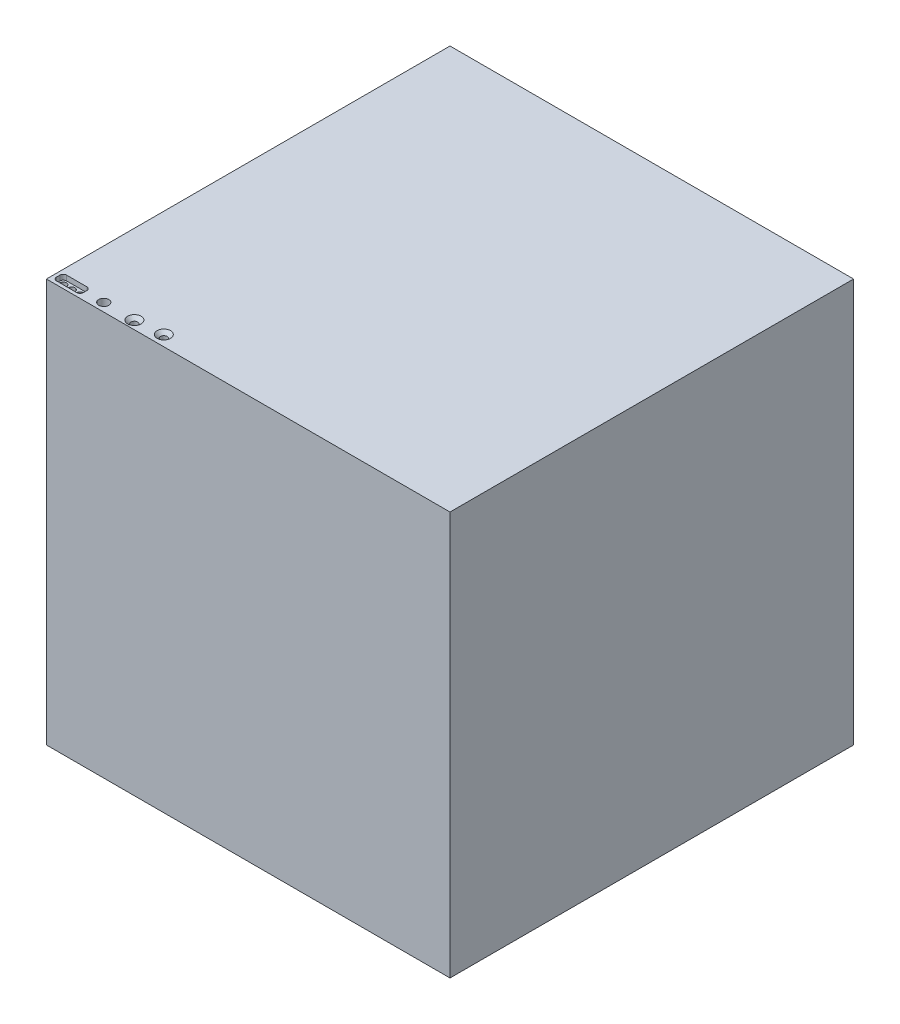
from build123d import *

# Parameters (mm, degrees)
SKETCH1_W           = 1200
SKETCH1_H           = 1200
BOSS_EXTRUDE1_DEPTH = 1200
SKETCH3_W           = 80
SKETCH3_H           = 30
CUT_EXTRUDE2_DEPTH  = 15
FILLET1_R           = 10
SKETCH4_R           = 10
CUT_EXTRUDE3_DEPTH  = 15
SKETCH5_R           = 10
CUT_EXTRUDE4_DEPTH  = 2070.8369501
SKETCH6_R           = 15
CUT_EXTRUDE5_DEPTH  = 100
SKETCH8_R           = 7.5
CUT_EXTRUDE6_DEPTH  = 100
SKETCH11_R          = 10
CUT_EXTRUDE7_DEPTH  = 250
CHAMFER1_SIZE       = 10
SKETCH12_R          = 10
CUT_EXTRUDE8_DEPTH  = 30.004
CHAMFER2_SIZE       = 10


with BuildPart() as part:
    # Sketch1 → Boss-Extrude1 (new body)
    with BuildSketch(Plane(origin=(0, 0, 0), x_dir=(1, 0, 0), z_dir=(0, 1, 0))):
        with Locations((600, 600)):
            Rectangle(SKETCH1_W, SKETCH1_H)
    extrude(amount=BOSS_EXTRUDE1_DEPTH)

    # Sketch3 → Cut-Extrude2 (cut)
    with BuildSketch(Plane(origin=(0, 1200, 0), x_dir=(1, 0, 0), z_dir=(0, 1, 0))):
        with Locations((50, 25)):
            Rectangle(SKETCH3_W, SKETCH3_H)
    extrude(amount=-CUT_EXTRUDE2_DEPTH, mode=Mode.SUBTRACT)

    # Fillet1
    fillet1_edges = [part.edges().sort_by_distance(p)[0] for p in [
        (10, 1192.5, -10),
        (10, 1192.5, -40),
        (90, 1192.5, -40),
        (90, 1192.5, -10),
    ]]
    fillet(fillet1_edges, radius=FILLET1_R)

    # Sketch4 → Cut-Extrude3 (cut)
    with BuildSketch(Plane(origin=(0, 1185, 0), x_dir=(1, 0, 0), z_dir=(0, 1, 0))):
        with Locations(Location((25, 25, 0), (0, 0, 270))):
            Circle(SKETCH4_R)
        with Locations(Location((75, 25, 0), (0, 0, 270))):
            Circle(SKETCH4_R)
    extrude(amount=-CUT_EXTRUDE3_DEPTH, mode=Mode.SUBTRACT)

    # Sketch5 → Cut-Extrude4 (cut, through all)
    with BuildSketch(Plane(origin=(0, 1185, 0), x_dir=(1, 0, 0), z_dir=(0, 1, 0))):
        with Locations(Location((50, 25, 0), (0, 0, 270))):
            Circle(SKETCH5_R)
    extrude(amount=-CUT_EXTRUDE4_DEPTH, mode=Mode.SUBTRACT)

    # Sketch6 → Cut-Extrude5 (cut)
    with BuildSketch(Plane(origin=(0, 1200, 0), x_dir=(1, 0, 0), z_dir=(0, 1, 0))):
        with Locations(Location((145.500055777, 25, 0), (0, 0, 270))):
            Circle(SKETCH6_R)
    extrude(amount=-CUT_EXTRUDE5_DEPTH, mode=Mode.SUBTRACT)

    # Sketch8 → Cut-Extrude6 (cut)
    with BuildSketch(Plane(origin=(0, 1100, 0), x_dir=(1, 0, 0), z_dir=(0, 1, 0))):
        with Locations(Location((145.500055777, 25, 0), (0, 0, 270))):
            Circle(SKETCH8_R)
    extrude(amount=-CUT_EXTRUDE6_DEPTH, mode=Mode.SUBTRACT)

    # Sketch11 → Cut-Extrude7 (cut)
    with BuildSketch(Plane(origin=(0, 1200, 0), x_dir=(1, 0, 0), z_dir=(0, 1, 0))):
        with Locations(Location((236.465344037, 25, 0), (0, 0, 270))):
            Circle(SKETCH11_R)
    extrude(amount=-CUT_EXTRUDE7_DEPTH, mode=Mode.SUBTRACT)

    # Chamfer1
    chamfer1_edges = [part.edges().sort_by_distance(p)[0] for p in [
        (236.465344037, 1200, -35),
    ]]
    chamfer(chamfer1_edges, length=CHAMFER1_SIZE)

    # Sketch12 → Cut-Extrude8 (cut)
    with BuildSketch(Plane(origin=(0, 1200, 0), x_dir=(1, 0, 0), z_dir=(0, 1, 0))):
        with Locations(Location((317.39806053, 31.612058329, 0), (0, 0, 270))):
            Circle(SKETCH12_R)
    extrude(amount=-CUT_EXTRUDE8_DEPTH, mode=Mode.SUBTRACT)

    # Chamfer2
    chamfer2_edges = [part.edges().sort_by_distance(p)[0] for p in [
        (317.39806053, 1200, -41.612058329),
    ]]
    chamfer(chamfer2_edges, length=CHAMFER2_SIZE)


solid = part.part
